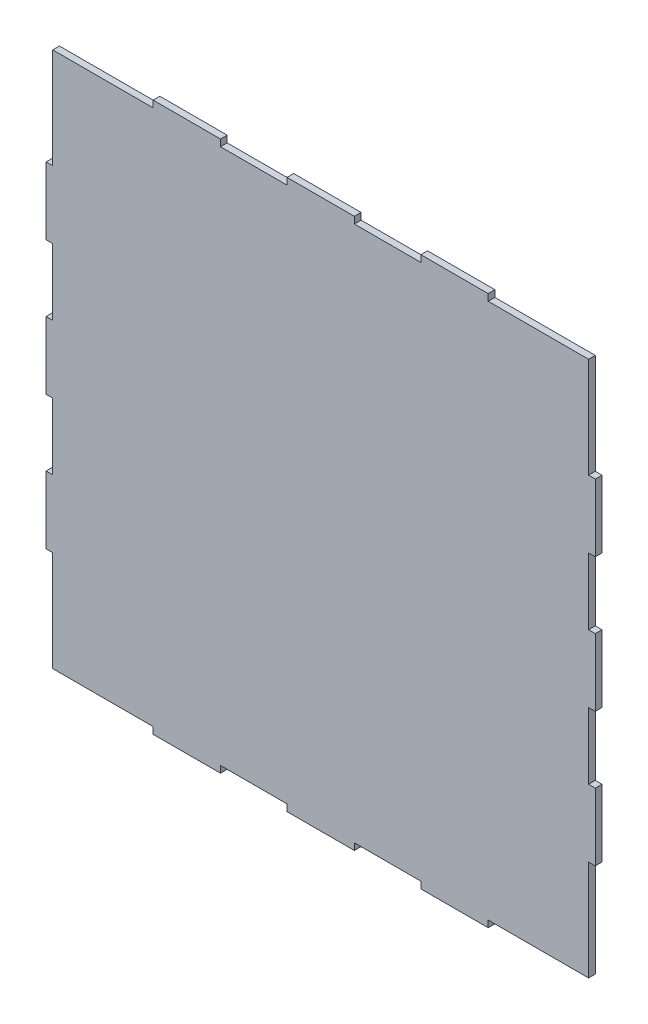
from build123d import *

# Parameters (mm, degrees)
SKIZZE1_W                       = 410
SKIZZE1_H                       = 410
AUFSATZ_LINEAR_AUSTRAGEN1_DEPTH = 5
SKIZZE2_W                       = 97.796702903
SKIZZE2_H                       = 49.6
SCHNITT_LINEAR_AUSTRAGEN1_DEPTH = 5
LINEARES_MUSTER1_COUNT          = 4
LINEARES_MUSTER1_PITCH          = 99.9
SPIEGELN1_COPY_1_SKETCH_W       = 97.796702903
SPIEGELN1_COPY_1_SKETCH_H       = 49.6
SPIEGELN1_COPY_1_DEPTH          = 5
SPIEGELN1_COPY_2_SKETCH_W       = 97.796702903
SPIEGELN1_COPY_2_SKETCH_H       = 49.6
SPIEGELN1_COPY_2_DEPTH          = 5
SPIEGELN1_COPY_3_SKETCH_W       = 97.796702903
SPIEGELN1_COPY_3_SKETCH_H       = 49.6
SPIEGELN1_COPY_3_DEPTH          = 5
SKIZZE3_W                       = 49.6
SKIZZE3_H                       = 41.77912255
SCHNITT_LINEAR_AUSTRAGEN2_DEPTH = 5
LINEARES_MUSTER2_COUNT          = 4
LINEARES_MUSTER2_PITCH          = 99.9
SPIEGELN2_COPY_1_SKETCH_W       = 49.6
SPIEGELN2_COPY_1_SKETCH_H       = 41.77912255
SPIEGELN2_COPY_1_DEPTH          = 5
SPIEGELN2_COPY_2_SKETCH_W       = 49.6
SPIEGELN2_COPY_2_SKETCH_H       = 41.77912255
SPIEGELN2_COPY_2_DEPTH          = 5
SPIEGELN2_COPY_3_SKETCH_W       = 49.6
SPIEGELN2_COPY_3_SKETCH_H       = 41.77912255
SPIEGELN2_COPY_3_DEPTH          = 5
SCHNITT_LINEAR_AUSTRAGEN3_DEPTH = 5
SPIEGELN4_COPY_1_DEPTH          = 5


with BuildPart() as part:
    # Skizze1 → Aufsatz-Linear austragen1 (new body)
    with BuildSketch(Plane.XY):
        with Locations((205, 205)):
            Rectangle(SKIZZE1_W, SKIZZE1_H)
    extrude(amount=AUFSATZ_LINEAR_AUSTRAGEN1_DEPTH)

    # Skizze2 → Schnitt-Linear austragen1 (cut)
    with BuildSketch(Plane.XY.offset(5)):
        with Locations((-43.898351452, 354.85)):
            Rectangle(SKIZZE2_W, SKIZZE2_H)
    schnitt_linear_austragen1 = extrude(amount=-SCHNITT_LINEAR_AUSTRAGEN1_DEPTH, mode=Mode.SUBTRACT)

    # Lineares Muster1: Schnitt-Linear austragen1 ×4
    with Locations(*[(0, -i * LINEARES_MUSTER1_PITCH, 0) for i in range(1, LINEARES_MUSTER1_COUNT)]):
        add(schnitt_linear_austragen1, mode=Mode.SUBTRACT)

    # Spiegeln1: Schnitt-Linear austragen1 across plane
    add(schnitt_linear_austragen1.mirror(Plane(origin=(205, 0, 0), x_dir=(0, 0, 1), z_dir=(1, 0, 0))), mode=Mode.SUBTRACT)

    # Spiegeln1 copy 1 sketch → Spiegeln1 copy 1 (cut)
    with BuildSketch(Plane(origin=(410, -99.9, 5), x_dir=(-1, 0, 0), z_dir=(0, 0, 1))):
        with Locations((-43.898351452, -354.85)):
            Rectangle(SPIEGELN1_COPY_1_SKETCH_W, SPIEGELN1_COPY_1_SKETCH_H)
    extrude(amount=-SPIEGELN1_COPY_1_DEPTH, mode=Mode.SUBTRACT)

    # Spiegeln1 copy 2 sketch → Spiegeln1 copy 2 (cut)
    with BuildSketch(Plane(origin=(410, -199.8, 5), x_dir=(-1, 0, 0), z_dir=(0, 0, 1))):
        with Locations((-43.898351452, -354.85)):
            Rectangle(SPIEGELN1_COPY_2_SKETCH_W, SPIEGELN1_COPY_2_SKETCH_H)
    extrude(amount=-SPIEGELN1_COPY_2_DEPTH, mode=Mode.SUBTRACT)

    # Spiegeln1 copy 3 sketch → Spiegeln1 copy 3 (cut)
    with BuildSketch(Plane(origin=(410, -299.7, 5), x_dir=(-1, 0, 0), z_dir=(0, 0, 1))):
        with Locations((-43.898351452, -354.85)):
            Rectangle(SPIEGELN1_COPY_3_SKETCH_W, SPIEGELN1_COPY_3_SKETCH_H)
    extrude(amount=-SPIEGELN1_COPY_3_DEPTH, mode=Mode.SUBTRACT)

    # Skizze3 → Schnitt-Linear austragen2 (cut)
    with BuildSketch(Plane.XY.offset(5)):
        with Locations((55.15, 425.889561275)):
            Rectangle(SKIZZE3_W, SKIZZE3_H)
    schnitt_linear_austragen2 = extrude(amount=-SCHNITT_LINEAR_AUSTRAGEN2_DEPTH, mode=Mode.SUBTRACT)

    # Lineares Muster2: Schnitt-Linear austragen2 ×4
    with Locations(*[(i * LINEARES_MUSTER2_PITCH, 0, 0) for i in range(1, LINEARES_MUSTER2_COUNT)]):
        add(schnitt_linear_austragen2, mode=Mode.SUBTRACT)

    # Spiegeln2: Schnitt-Linear austragen2 across plane
    add(schnitt_linear_austragen2.mirror(Plane.ZX.offset(205)), mode=Mode.SUBTRACT)

    # Spiegeln2 copy 1 sketch → Spiegeln2 copy 1 (cut)
    with BuildSketch(Plane(origin=(99.9, 410, 5), x_dir=(1, 0, 0), z_dir=(0, 0, 1))):
        with Locations((55.15, -425.889561275)):
            Rectangle(SPIEGELN2_COPY_1_SKETCH_W, SPIEGELN2_COPY_1_SKETCH_H)
    extrude(amount=-SPIEGELN2_COPY_1_DEPTH, mode=Mode.SUBTRACT)

    # Spiegeln2 copy 2 sketch → Spiegeln2 copy 2 (cut)
    with BuildSketch(Plane(origin=(199.8, 410, 5), x_dir=(1, 0, 0), z_dir=(0, 0, 1))):
        with Locations((55.15, -425.889561275)):
            Rectangle(SPIEGELN2_COPY_2_SKETCH_W, SPIEGELN2_COPY_2_SKETCH_H)
    extrude(amount=-SPIEGELN2_COPY_2_DEPTH, mode=Mode.SUBTRACT)

    # Spiegeln2 copy 3 sketch → Spiegeln2 copy 3 (cut)
    with BuildSketch(Plane(origin=(299.7, 410, 5), x_dir=(1, 0, 0), z_dir=(0, 0, 1))):
        with Locations((55.15, -425.889561275)):
            Rectangle(SPIEGELN2_COPY_3_SKETCH_W, SPIEGELN2_COPY_3_SKETCH_H)
    extrude(amount=-SPIEGELN2_COPY_3_DEPTH, mode=Mode.SUBTRACT)

    # Skizze4 → Schnitt-Linear austragen3 (cut)
    with BuildSketch(Plane.XY.offset(5)):
        Polygon((5, 379.65), (5, 405), (30.35, 405), (30.35, 431.549801047), (5, 431.549801047), (-47.862925009, 431.549801047), (-47.862925009, 405), (-47.862925009, 379.65), align=None)
    schnitt_linear_austragen3 = extrude(amount=-SCHNITT_LINEAR_AUSTRAGEN3_DEPTH, mode=Mode.SUBTRACT)

    # Spiegeln3: Schnitt-Linear austragen3 across plane
    add(schnitt_linear_austragen3.mirror(Plane(origin=(205, 0, 0), x_dir=(0, 0, 1), z_dir=(1, 0, 0))), mode=Mode.SUBTRACT)

    # Spiegeln4: Schnitt-Linear austragen3 across plane
    add(schnitt_linear_austragen3.mirror(Plane.ZX.offset(205)), mode=Mode.SUBTRACT)

    # Spiegeln4 copy 1 sketch → Spiegeln4 copy 1 (cut)
    with BuildSketch(Plane(origin=(410, 410, 5), x_dir=(-1, 0, 0), z_dir=(0, 0, 1))):
        Polygon((5, 379.65), (5, 405), (30.35, 405), (30.35, 431.549801047), (5, 431.549801047), (-47.862925009, 431.549801047), (-47.862925009, 405), (-47.862925009, 379.65), align=None)
    extrude(amount=-SPIEGELN4_COPY_1_DEPTH, mode=Mode.SUBTRACT)


solid = part.part
